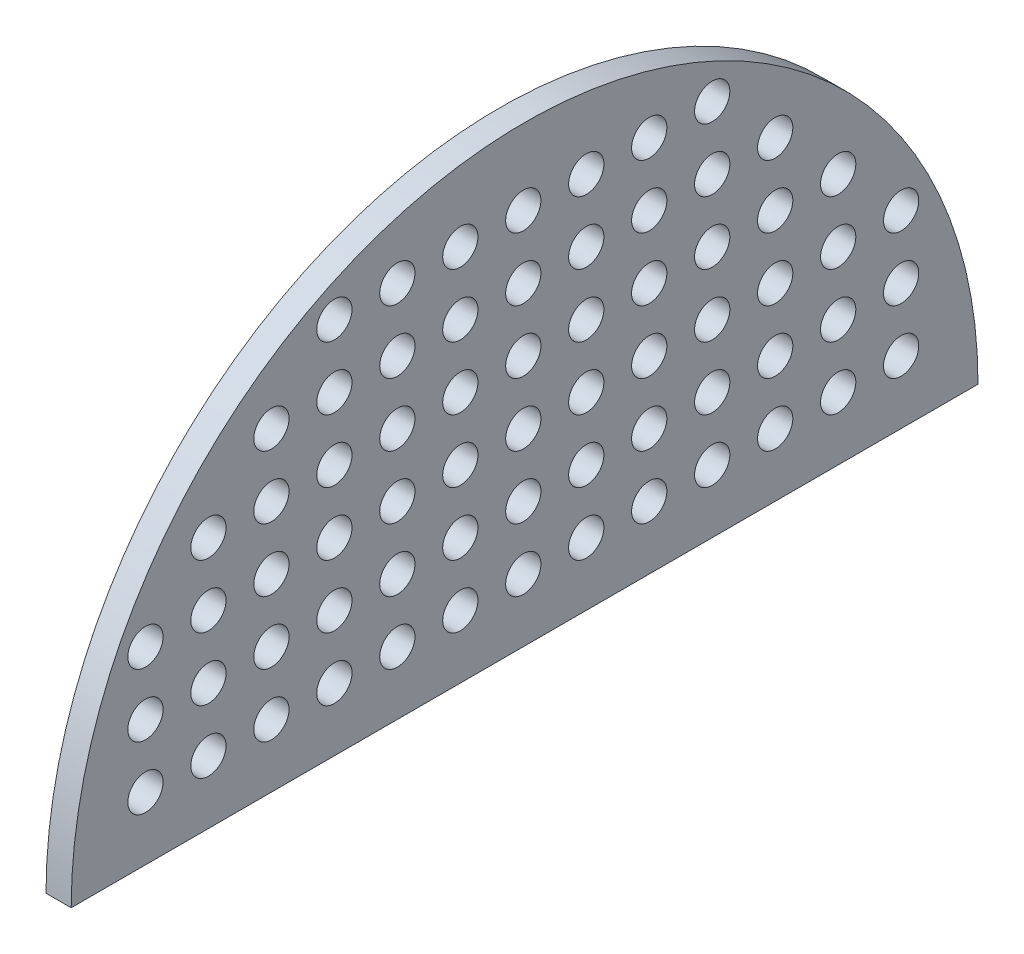
from build123d import *

# Parameters (mm, degrees)
BOSS_EXTRUDE2_DEPTH = 10
SKETCH4_R           = 7
CUT_EXTRUDE2_DEPTH  = 10


with BuildPart() as part:
    # Sketch3 → Boss-Extrude2 (new body)
    with BuildSketch(Plane(origin=(0, 0, 0), x_dir=(0, 0, -1), z_dir=(1, 0, 0))):
        with BuildLine():
            Line((-168.70292887, 0), (191.29707113, 0))
            ThreePointArc((191.29707113, 0), (11.29707113, 180), (-168.70292887, 0))
        make_face()
    extrude(amount=BOSS_EXTRUDE2_DEPTH)

    # Sketch4 → Cut-Extrude2 (cut)
    with BuildSketch(Plane.ZY):
        with Locations((-160.781790175, 25)):
            Circle(SKETCH4_R)
        with Locations((-135.781790175, 25)):
            Circle(SKETCH4_R)
        with Locations((-110.781790175, 25)):
            Circle(SKETCH4_R)
        with Locations((-85.781790175, 25)):
            Circle(SKETCH4_R)
        with Locations((-60.781790175, 25)):
            Circle(SKETCH4_R)
        with Locations((-35.781790175, 25)):
            Circle(SKETCH4_R)
        with Locations((-10.781790175, 25)):
            Circle(SKETCH4_R)
        with Locations((14.218209825, 25)):
            Circle(SKETCH4_R)
        with Locations((39.218209825, 25)):
            Circle(SKETCH4_R)
        with Locations((64.218209825, 25)):
            Circle(SKETCH4_R)
        with Locations((89.218209825, 25)):
            Circle(SKETCH4_R)
        with Locations((114.218209825, 25)):
            Circle(SKETCH4_R)
        with Locations((139.218209825, 25)):
            Circle(SKETCH4_R)
        with Locations((-135.781790175, 50)):
            Circle(SKETCH4_R)
        with Locations((-110.781790175, 50)):
            Circle(SKETCH4_R)
        with Locations((-85.781790175, 50)):
            Circle(SKETCH4_R)
        with Locations((-60.781790175, 50)):
            Circle(SKETCH4_R)
        with Locations((-35.781790175, 50)):
            Circle(SKETCH4_R)
        with Locations((-10.781790175, 50)):
            Circle(SKETCH4_R)
        with Locations((14.218209825, 50)):
            Circle(SKETCH4_R)
        with Locations((39.218209825, 50)):
            Circle(SKETCH4_R)
        with Locations((64.218209825, 50)):
            Circle(SKETCH4_R)
        with Locations((89.218209825, 50)):
            Circle(SKETCH4_R)
        with Locations((114.218209825, 50)):
            Circle(SKETCH4_R)
        with Locations((139.218209825, 50)):
            Circle(SKETCH4_R)
        with Locations((-135.781790175, 75)):
            Circle(SKETCH4_R)
        with Locations((-110.781790175, 75)):
            Circle(SKETCH4_R)
        with Locations((-85.781790175, 75)):
            Circle(SKETCH4_R)
        with Locations((-60.781790175, 75)):
            Circle(SKETCH4_R)
        with Locations((-35.781790175, 75)):
            Circle(SKETCH4_R)
        with Locations((-10.781790175, 75)):
            Circle(SKETCH4_R)
        with Locations((14.218209825, 75)):
            Circle(SKETCH4_R)
        with Locations((39.218209825, 75)):
            Circle(SKETCH4_R)
        with Locations((64.218209825, 75)):
            Circle(SKETCH4_R)
        with Locations((89.218209825, 75)):
            Circle(SKETCH4_R)
        with Locations((114.218209825, 75)):
            Circle(SKETCH4_R)
        with Locations((139.218209825, 75)):
            Circle(SKETCH4_R)
        with Locations((-135.781790175, 100)):
            Circle(SKETCH4_R)
        with Locations((-110.781790175, 100)):
            Circle(SKETCH4_R)
        with Locations((-85.781790175, 100)):
            Circle(SKETCH4_R)
        with Locations((-60.781790175, 100)):
            Circle(SKETCH4_R)
        with Locations((-35.781790175, 100)):
            Circle(SKETCH4_R)
        with Locations((-10.781790175, 100)):
            Circle(SKETCH4_R)
        with Locations((14.218209825, 100)):
            Circle(SKETCH4_R)
        with Locations((39.218209825, 100)):
            Circle(SKETCH4_R)
        with Locations((64.218209825, 100)):
            Circle(SKETCH4_R)
        with Locations((89.218209825, 100)):
            Circle(SKETCH4_R)
        with Locations((114.218209825, 100)):
            Circle(SKETCH4_R)
        with Locations((-110.781790175, 125)):
            Circle(SKETCH4_R)
        with Locations((-85.781790175, 125)):
            Circle(SKETCH4_R)
        with Locations((-60.781790175, 125)):
            Circle(SKETCH4_R)
        with Locations((-35.781790175, 125)):
            Circle(SKETCH4_R)
        with Locations((-10.781790175, 125)):
            Circle(SKETCH4_R)
        with Locations((14.218209825, 125)):
            Circle(SKETCH4_R)
        with Locations((39.218209825, 125)):
            Circle(SKETCH4_R)
        with Locations((64.218209825, 125)):
            Circle(SKETCH4_R)
        with Locations((89.218209825, 125)):
            Circle(SKETCH4_R)
        with Locations((-85.781790175, 150)):
            Circle(SKETCH4_R)
        with Locations((-60.781790175, 150)):
            Circle(SKETCH4_R)
        with Locations((-35.781790175, 150)):
            Circle(SKETCH4_R)
        with Locations((-10.781790175, 150)):
            Circle(SKETCH4_R)
        with Locations((14.218209825, 150)):
            Circle(SKETCH4_R)
        with Locations((39.218209825, 150)):
            Circle(SKETCH4_R)
        with Locations((64.218209825, 150)):
            Circle(SKETCH4_R)
        with Locations((-160.781790175, 50)):
            Circle(SKETCH4_R)
        with Locations((-160.781790175, 75)):
            Circle(SKETCH4_R)
    extrude(amount=-CUT_EXTRUDE2_DEPTH, mode=Mode.SUBTRACT)


solid = part.part
